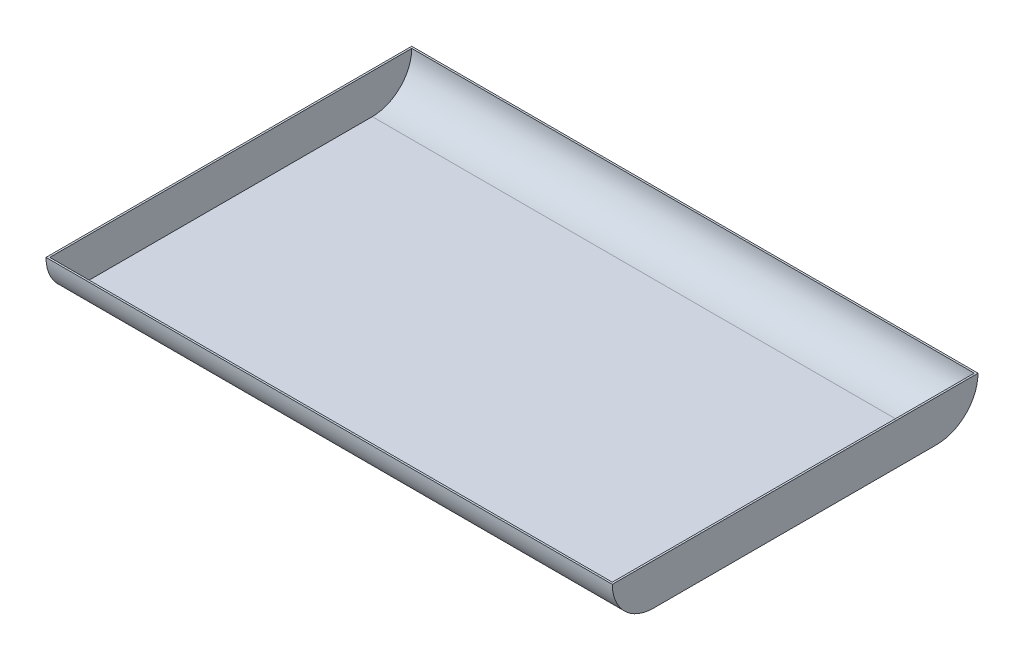
from build123d import *

# Parameters (mm, degrees)
COVERBASEEXTRUDE_DEPTH      = 304.8
COVERBASEEXTRUDE_DEPTH_BACK = 304.8
COVERSHELL_T                = -2


with BuildPart() as part:
    # Sketch1 → CoverBaseExtrude (new, two sides: drawn at the far end of the back side and taken through both)
    with BuildSketch(Plane(origin=(0, 0, 0), x_dir=(0, 0, -1), z_dir=(1, 0, 0)).offset(-COVERBASEEXTRUDE_DEPTH_BACK)):
        with BuildLine():
            Line((-152.4, 0), (152.4, 0))
            ThreePointArc((152.4, 0), (183.830896424, 13.019103576), (196.85, 44.45))
            Line((196.85, 44.45), (-196.85, 44.45))
            ThreePointArc((-196.85, 44.45), (-183.830896424, 13.019103576), (-152.4, 0))
        make_face()
    extrude(amount=COVERBASEEXTRUDE_DEPTH + COVERBASEEXTRUDE_DEPTH_BACK)

    # CoverShell
    covershell_openings = [part.faces().sort_by_distance(p)[0] for p in [
        (0, 44.45, 0),
    ]]
    offset(amount=COVERSHELL_T, openings=covershell_openings, kind=Kind.INTERSECTION)


solid = part.part
